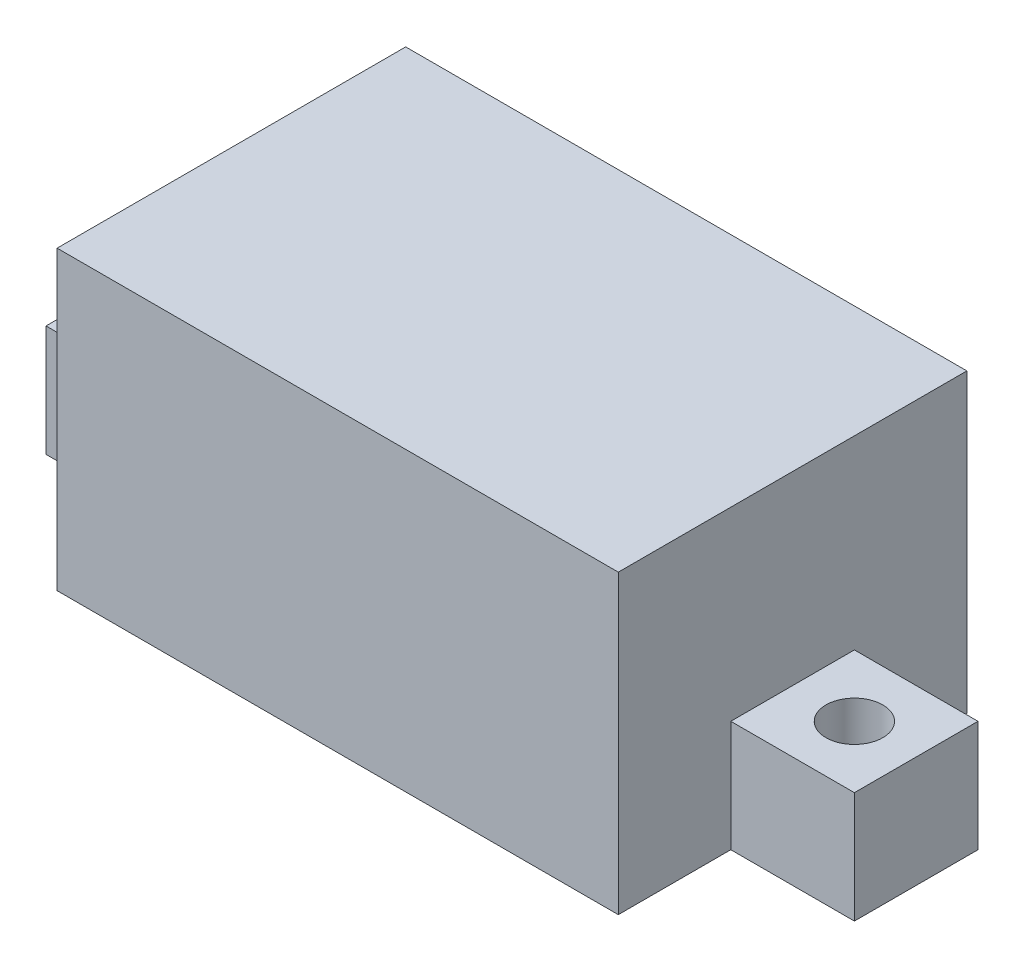
from build123d import *

# Parameters (mm, degrees)
SKETCH_1_W      = 22.7
SKETCH_1_H      = 14.1
EXTRUDE_1_DEPTH = 12
SKETCH_2_W      = 5
SKETCH_2_H      = 5
SKETCH_2_R      = 1.15
EXTRUDE_2_DEPTH = 4.5


with BuildPart() as part:
    # ｽｹｯﾁ1 → ﾎﾞｽ - 押し出し1 (new body)
    with BuildSketch(Plane(origin=(0, 0, 0), x_dir=(1, 0, 0), z_dir=(0, 1, 0))):
        with Locations((11.35, 7.05)):
            Rectangle(SKETCH_1_W, SKETCH_1_H)
    extrude(amount=EXTRUDE_1_DEPTH)

    # ｽｹｯﾁ2 → ﾎﾞｽ - 押し出し2 (add)
    # profile 1 of 2: a face of its own
    with BuildSketch(Plane.XZ):
        with Locations((-2.5, -7.05)):
            Rectangle(SKETCH_2_W, SKETCH_2_H)
        with Locations(Location((-2.5, -7.05, 0), (0, 0, 270))):
            Circle(SKETCH_2_R, mode=Mode.SUBTRACT)
    # profile 2 of 2: a face of its own
    with BuildSketch(Plane.XZ):
        with Locations((25.2, -7.05)):
            Rectangle(SKETCH_2_W, SKETCH_2_H)
        with Locations(Location((25.2, -7.05, 0), (0, 0, 90))):
            Circle(SKETCH_2_R, mode=Mode.SUBTRACT)
    extrude(amount=-EXTRUDE_2_DEPTH)


solid = part.part
